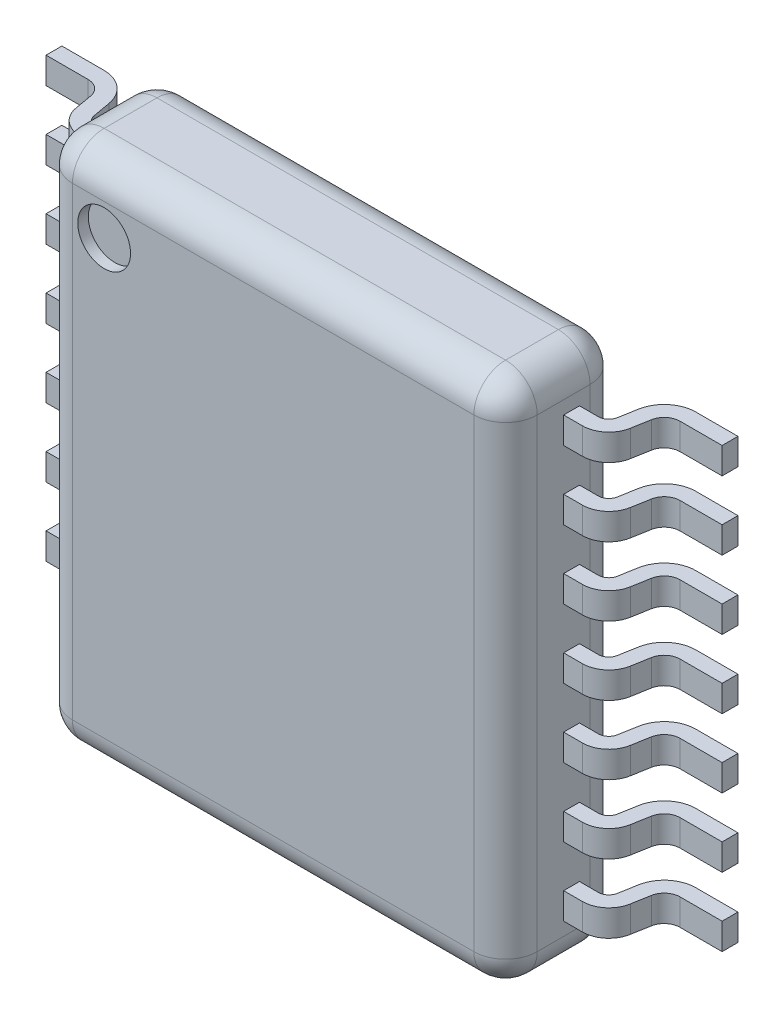
from build123d import *

# Parameters (mm, degrees)
BOSS_EXTRUDE1_START  = 0.1
SKETCH1_W            = 4.4
SKETCH1_H            = 5
BOSS_EXTRUDE1_DEPTH  = 1.1
FILLET1_R            = 0.3
SKETCH2_R            = 0.25
CUT_EXTRUDE1_DEPTH   = 0.1
BOSS_EXTRUDE2_START  = 1.95
BOSS_EXTRUDE2_DEPTH  = 0.125
LPATTERN1_COUNT      = 7
LPATTERN1_PITCH      = 0.65
MIRROR1_START        = 1.95
MIRROR1_COPY_1_DEPTH = 0.125
MIRROR1_COPY_2_DEPTH = 0.125
MIRROR1_COPY_3_DEPTH = 0.125
MIRROR1_COPY_4_DEPTH = 0.125
MIRROR1_COPY_5_DEPTH = 0.125
MIRROR1_COPY_6_DEPTH = 0.125
SKETCH4_W            = 1.65
SKETCH4_H            = 1.35
CUT_EXTRUDE2_DEPTH   = 0.01


with BuildPart() as part:
    # Sketch1 → Boss-Extrude1 (new body)
    with BuildSketch(Plane.XY.offset(BOSS_EXTRUDE1_START)):
        Rectangle(SKETCH1_W, SKETCH1_H)
    extrude(amount=BOSS_EXTRUDE1_DEPTH)

    # Fillet1
    fillet1_edges = [part.edges().sort_by_distance(p)[0] for p in [
        (2.2, 2.5, 0.65),
        (0, 2.5, 0.1),
        (-2.2, 2.5, 0.65),
        (-2.2, 0, 0.1),
        (-2.2, -2.5, 0.65),
        (0, -2.5, 0.1),
        (0, -2.5, 1.2),
        (2.2, 0, 1.2),
        (0, 2.5, 1.2),
        (-2.2, 0, 1.2),
        (2.2, -2.5, 0.65),
        (2.2, 0, 0.1),
    ]]
    fillet(fillet1_edges, radius=FILLET1_R)

    # Sketch2 → Cut-Extrude1 (cut)
    with BuildSketch(Plane.XY.offset(1.2)):
        with Locations((-1.6, 1.9)):
            Circle(SKETCH2_R)
    extrude(amount=-CUT_EXTRUDE1_DEPTH, mode=Mode.SUBTRACT)

    # Sketch3 → Boss-Extrude2 (add, symmetric)
    with BuildSketch(Plane(origin=(0, 0, 0), x_dir=(1, 0, 0), z_dir=(0, 1, 0)).offset(BOSS_EXTRUDE2_START)):
        with BuildLine():
            Line((-3.2, 0), (-2.801729889, 0))
            ThreePointArc((-2.801729889, 0), (-2.608893606, -0.070186667), (-2.506287563, -0.247905547))
            Line((-2.506287563, -0.247905547), (-2.476407322, -0.417364818))
            ThreePointArc((-2.476407322, -0.417364818), (-2.442205307, -0.476604444), (-2.377926547, -0.5))
            Line((-2.377926547, -0.5), (-2.2, -0.5))
            Line((-2.2, -0.5), (-2.2, -0.65))
            Line((-2.2, -0.65), (-2.377926547, -0.65))
            ThreePointArc((-2.377926547, -0.65), (-2.538623449, -0.591511111), (-2.624128485, -0.443412044))
            Line((-2.624128485, -0.443412044), (-2.654008726, -0.273952773))
            ThreePointArc((-2.654008726, -0.273952773), (-2.705311748, -0.185093334), (-2.801729889, -0.15))
            Line((-2.801729889, -0.15), (-3.2, -0.15))
            Line((-3.2, -0.15), (-3.2, 0))
        make_face()
    boss_extrude2 = extrude(amount=BOSS_EXTRUDE2_DEPTH, both=True)

    # LPattern1: Boss-Extrude2 ×7
    with Locations(*[(0, -i * LPATTERN1_PITCH, 0) for i in range(1, LPATTERN1_COUNT)]):
        add(boss_extrude2)

    # Mirror1: Boss-Extrude2 across plane
    add(boss_extrude2.mirror(Plane(origin=(0, 0, 0), x_dir=(0, 0, 1), z_dir=(1, 0, 0))))

    # Mirror1 copy 1 sketch → Mirror1 copy 1 (add, symmetric)
    with BuildSketch(Plane(origin=(0, -0.65, 0), x_dir=(-1, 0, 0), z_dir=(0, 1, 0)).offset(MIRROR1_START)):
        with BuildLine():
            Line((-3.2, 0), (-2.801729889, 0))
            ThreePointArc((-2.801729889, 0), (-2.608893606, 0.070186667), (-2.506287563, 0.247905547))
            Line((-2.506287563, 0.247905547), (-2.476407322, 0.417364818))
            ThreePointArc((-2.476407322, 0.417364818), (-2.442205307, 0.476604444), (-2.377926547, 0.5))
            Line((-2.377926547, 0.5), (-2.2, 0.5))
            Line((-2.2, 0.5), (-2.2, 0.65))
            Line((-2.2, 0.65), (-2.377926547, 0.65))
            ThreePointArc((-2.377926547, 0.65), (-2.538623449, 0.591511111), (-2.624128485, 0.443412044))
            Line((-2.624128485, 0.443412044), (-2.654008726, 0.273952773))
            ThreePointArc((-2.654008726, 0.273952773), (-2.705311748, 0.185093334), (-2.801729889, 0.15))
            Line((-2.801729889, 0.15), (-3.2, 0.15))
            Line((-3.2, 0.15), (-3.2, 0))
        make_face()
    extrude(amount=MIRROR1_COPY_1_DEPTH, both=True)

    # Mirror1 copy 2 sketch → Mirror1 copy 2 (add, symmetric)
    with BuildSketch(Plane(origin=(0, -1.3, 0), x_dir=(-1, 0, 0), z_dir=(0, 1, 0)).offset(MIRROR1_START)):
        with BuildLine():
            Line((-3.2, 0), (-2.801729889, 0))
            ThreePointArc((-2.801729889, 0), (-2.608893606, 0.070186667), (-2.506287563, 0.247905547))
            Line((-2.506287563, 0.247905547), (-2.476407322, 0.417364818))
            ThreePointArc((-2.476407322, 0.417364818), (-2.442205307, 0.476604444), (-2.377926547, 0.5))
            Line((-2.377926547, 0.5), (-2.2, 0.5))
            Line((-2.2, 0.5), (-2.2, 0.65))
            Line((-2.2, 0.65), (-2.377926547, 0.65))
            ThreePointArc((-2.377926547, 0.65), (-2.538623449, 0.591511111), (-2.624128485, 0.443412044))
            Line((-2.624128485, 0.443412044), (-2.654008726, 0.273952773))
            ThreePointArc((-2.654008726, 0.273952773), (-2.705311748, 0.185093334), (-2.801729889, 0.15))
            Line((-2.801729889, 0.15), (-3.2, 0.15))
            Line((-3.2, 0.15), (-3.2, 0))
        make_face()
    extrude(amount=MIRROR1_COPY_2_DEPTH, both=True)

    # Mirror1 copy 3 sketch → Mirror1 copy 3 (add, symmetric)
    with BuildSketch(Plane(origin=(0, -1.95, 0), x_dir=(-1, 0, 0), z_dir=(0, 1, 0)).offset(MIRROR1_START)):
        with BuildLine():
            Line((-3.2, 0), (-2.801729889, 0))
            ThreePointArc((-2.801729889, 0), (-2.608893606, 0.070186667), (-2.506287563, 0.247905547))
            Line((-2.506287563, 0.247905547), (-2.476407322, 0.417364818))
            ThreePointArc((-2.476407322, 0.417364818), (-2.442205307, 0.476604444), (-2.377926547, 0.5))
            Line((-2.377926547, 0.5), (-2.2, 0.5))
            Line((-2.2, 0.5), (-2.2, 0.65))
            Line((-2.2, 0.65), (-2.377926547, 0.65))
            ThreePointArc((-2.377926547, 0.65), (-2.538623449, 0.591511111), (-2.624128485, 0.443412044))
            Line((-2.624128485, 0.443412044), (-2.654008726, 0.273952773))
            ThreePointArc((-2.654008726, 0.273952773), (-2.705311748, 0.185093334), (-2.801729889, 0.15))
            Line((-2.801729889, 0.15), (-3.2, 0.15))
            Line((-3.2, 0.15), (-3.2, 0))
        make_face()
    extrude(amount=MIRROR1_COPY_3_DEPTH, both=True)

    # Mirror1 copy 4 sketch → Mirror1 copy 4 (add, symmetric)
    with BuildSketch(Plane(origin=(0, -2.6, 0), x_dir=(-1, 0, 0), z_dir=(0, 1, 0)).offset(MIRROR1_START)):
        with BuildLine():
            Line((-3.2, 0), (-2.801729889, 0))
            ThreePointArc((-2.801729889, 0), (-2.608893606, 0.070186667), (-2.506287563, 0.247905547))
            Line((-2.506287563, 0.247905547), (-2.476407322, 0.417364818))
            ThreePointArc((-2.476407322, 0.417364818), (-2.442205307, 0.476604444), (-2.377926547, 0.5))
            Line((-2.377926547, 0.5), (-2.2, 0.5))
            Line((-2.2, 0.5), (-2.2, 0.65))
            Line((-2.2, 0.65), (-2.377926547, 0.65))
            ThreePointArc((-2.377926547, 0.65), (-2.538623449, 0.591511111), (-2.624128485, 0.443412044))
            Line((-2.624128485, 0.443412044), (-2.654008726, 0.273952773))
            ThreePointArc((-2.654008726, 0.273952773), (-2.705311748, 0.185093334), (-2.801729889, 0.15))
            Line((-2.801729889, 0.15), (-3.2, 0.15))
            Line((-3.2, 0.15), (-3.2, 0))
        make_face()
    extrude(amount=MIRROR1_COPY_4_DEPTH, both=True)

    # Mirror1 copy 5 sketch → Mirror1 copy 5 (add, symmetric)
    with BuildSketch(Plane(origin=(0, -3.25, 0), x_dir=(-1, 0, 0), z_dir=(0, 1, 0)).offset(MIRROR1_START)):
        with BuildLine():
            Line((-3.2, 0), (-2.801729889, 0))
            ThreePointArc((-2.801729889, 0), (-2.608893606, 0.070186667), (-2.506287563, 0.247905547))
            Line((-2.506287563, 0.247905547), (-2.476407322, 0.417364818))
            ThreePointArc((-2.476407322, 0.417364818), (-2.442205307, 0.476604444), (-2.377926547, 0.5))
            Line((-2.377926547, 0.5), (-2.2, 0.5))
            Line((-2.2, 0.5), (-2.2, 0.65))
            Line((-2.2, 0.65), (-2.377926547, 0.65))
            ThreePointArc((-2.377926547, 0.65), (-2.538623449, 0.591511111), (-2.624128485, 0.443412044))
            Line((-2.624128485, 0.443412044), (-2.654008726, 0.273952773))
            ThreePointArc((-2.654008726, 0.273952773), (-2.705311748, 0.185093334), (-2.801729889, 0.15))
            Line((-2.801729889, 0.15), (-3.2, 0.15))
            Line((-3.2, 0.15), (-3.2, 0))
        make_face()
    extrude(amount=MIRROR1_COPY_5_DEPTH, both=True)

    # Mirror1 copy 6 sketch → Mirror1 copy 6 (add, symmetric)
    with BuildSketch(Plane(origin=(0, -3.9, 0), x_dir=(-1, 0, 0), z_dir=(0, 1, 0)).offset(MIRROR1_START)):
        with BuildLine():
            Line((-3.2, 0), (-2.801729889, 0))
            ThreePointArc((-2.801729889, 0), (-2.608893606, 0.070186667), (-2.506287563, 0.247905547))
            Line((-2.506287563, 0.247905547), (-2.476407322, 0.417364818))
            ThreePointArc((-2.476407322, 0.417364818), (-2.442205307, 0.476604444), (-2.377926547, 0.5))
            Line((-2.377926547, 0.5), (-2.2, 0.5))
            Line((-2.2, 0.5), (-2.2, 0.65))
            Line((-2.2, 0.65), (-2.377926547, 0.65))
            ThreePointArc((-2.377926547, 0.65), (-2.538623449, 0.591511111), (-2.624128485, 0.443412044))
            Line((-2.624128485, 0.443412044), (-2.654008726, 0.273952773))
            ThreePointArc((-2.654008726, 0.273952773), (-2.705311748, 0.185093334), (-2.801729889, 0.15))
            Line((-2.801729889, 0.15), (-3.2, 0.15))
            Line((-3.2, 0.15), (-3.2, 0))
        make_face()
    extrude(amount=MIRROR1_COPY_6_DEPTH, both=True)

    # Sketch4 → Cut-Extrude2 (cut)
    with BuildSketch(Plane(origin=(0, 0, 0.1), x_dir=(-1, 0, 0), z_dir=(0, 0, -1))):
        Rectangle(SKETCH4_W, SKETCH4_H)
    extrude(amount=-CUT_EXTRUDE2_DEPTH, mode=Mode.SUBTRACT)


solid = part.part
